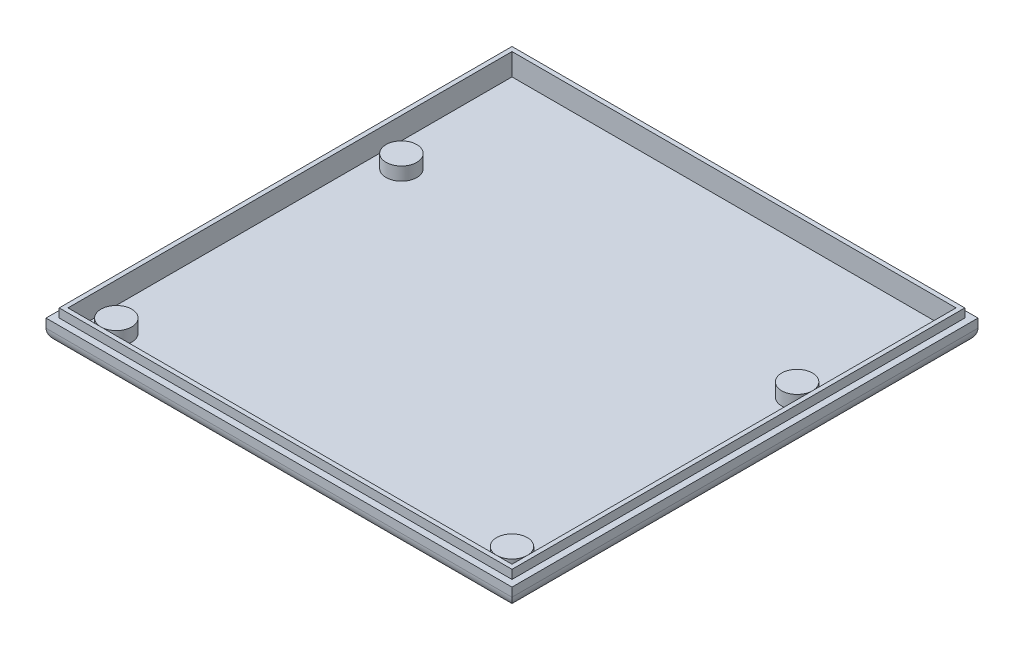
from build123d import *

# Parameters (mm, degrees)
SKETCH4_W           = 106
SKETCH4_H           = 106
BOSS_EXTRUDE3_DEPTH = 5
SKETCH6_W           = 101
SKETCH6_H           = 101
CUT_EXTRUDE2_DEPTH  = 3
SKETCH7_R           = 3.5
BOSS_EXTRUDE4_DEPTH = 3
FILLET1_R           = 3
SKETCH10_W          = 103
SKETCH10_H          = 103
SKETCH10_W_2        = 101
SKETCH10_H_2        = 101
BOSS_EXTRUDE5_DEPTH = 2


with BuildPart() as part:
    # Sketch4 → Boss-Extrude3 (new body)
    with BuildSketch(Plane(origin=(0, 0, 0), x_dir=(1, 0, 0), z_dir=(0, 1, 0))):
        with Locations((-47.689542484, -44.460784314)):
            Rectangle(SKETCH4_W, SKETCH4_H)
    extrude(amount=BOSS_EXTRUDE3_DEPTH)

    # Sketch6 → Cut-Extrude2 (cut)
    with BuildSketch(Plane(origin=(0, 5, 0), x_dir=(1, 0, 0), z_dir=(0, 1, 0))):
        with Locations((-47.689542484, -44.460784314)):
            Rectangle(SKETCH6_W, SKETCH6_H)
    extrude(amount=-CUT_EXTRUDE2_DEPTH, mode=Mode.SUBTRACT)

    # Sketch7 → Boss-Extrude4 (add)
    with BuildSketch(Plane(origin=(0, 2, 0), x_dir=(1, 0, 0), z_dir=(0, 1, 0))):
        with Locations(Location((-92.689542484, -24.610784314, 0), (0, 0, 270))):
            Circle(SKETCH7_R)
        with Locations(Location((-92.689542484, -89.460784314, 0), (0, 0, 270))):
            Circle(SKETCH7_R)
        with Locations(Location((-2.689542484, -89.460784314, 0), (0, 0, 270))):
            Circle(SKETCH7_R)
        with Locations(Location((-2.689542484, -24.610784314, 0), (0, 0, 270))):
            Circle(SKETCH7_R)
    extrude(amount=BOSS_EXTRUDE4_DEPTH)

    # Fillet1
    fillet1_edges = [part.edges().sort_by_distance(p)[0] for p in [
        (-47.689542484, 0, 97.460784314),
        (-100.689542484, 0, 44.460784314),
        (-47.689542484, 0, -8.539215686),
        (5.310457516, 0, 44.460784314),
    ]]
    fillet(fillet1_edges, radius=FILLET1_R)

    # Sketch10 → Boss-Extrude5 (add)
    with BuildSketch(Plane(origin=(0, 5, 0), x_dir=(1, 0, 0), z_dir=(0, 1, 0))):
        with Locations((-47.689542484, -44.460784314)):
            Rectangle(SKETCH10_W, SKETCH10_H)
        with Locations((-47.689542484, -44.460784314)):
            Rectangle(SKETCH10_W_2, SKETCH10_H_2, mode=Mode.SUBTRACT)
    extrude(amount=BOSS_EXTRUDE5_DEPTH)


solid = part.part
